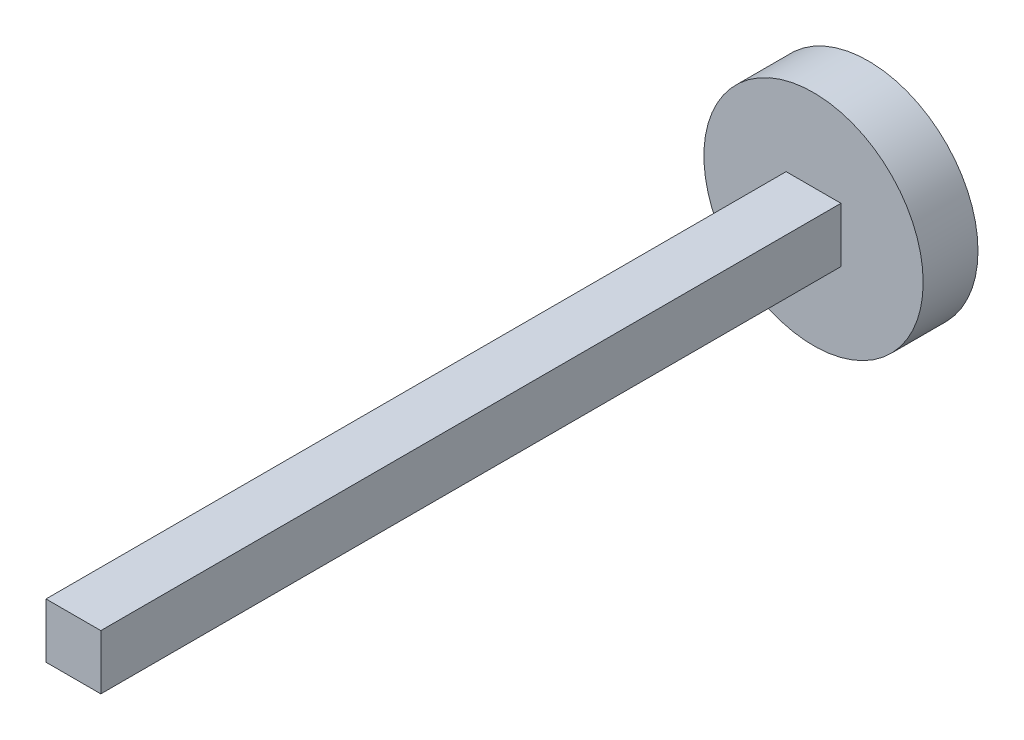
from build123d import *

# Parameters (mm, degrees)
SKETCH1_R           = 40
BOSS_EXTRUDE1_DEPTH = 20
SKETCH2_W           = 20
SKETCH2_H           = 20
BOSS_EXTRUDE2_DEPTH = 270


with BuildPart() as part:
    # Sketch1 → Boss-Extrude1 (new body)
    with BuildSketch(Plane.XY):
        Circle(SKETCH1_R)
    extrude(amount=BOSS_EXTRUDE1_DEPTH)

    # Sketch2 → Boss-Extrude2 (add)
    with BuildSketch(Plane.XY.offset(20)):
        Rectangle(SKETCH2_W, SKETCH2_H)
    extrude(amount=BOSS_EXTRUDE2_DEPTH)


solid = part.part
